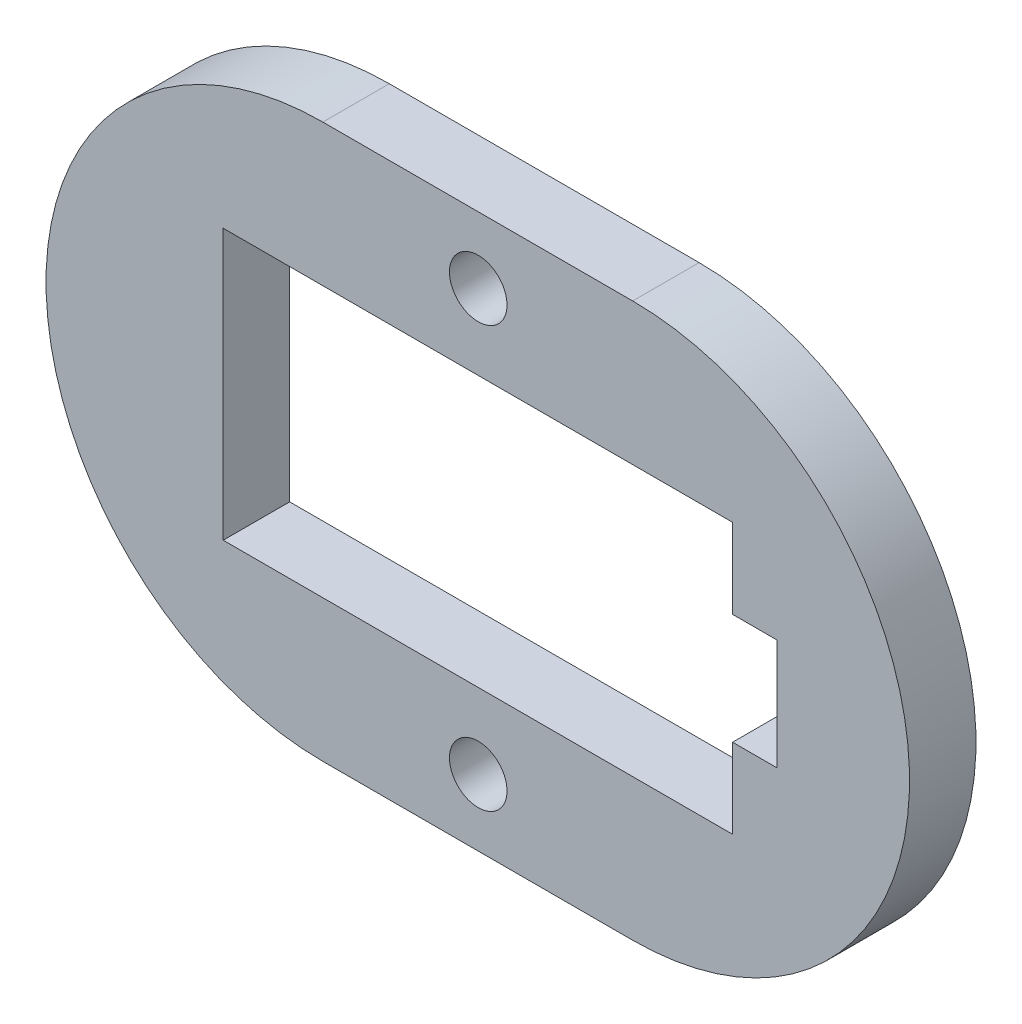
from build123d import *

# Parameters (mm, degrees)
SKETCH_1_R      = 1.3
EXTRUDE_1_DEPTH = 3


with BuildPart() as part:
    # 草图1 → 凸台-拉伸1 (new body)
    with BuildSketch(Plane.XY.offset(3)):
        with BuildLine():
            Line((-8.503322156, 0.0005), (5.486588529, 0.0005))
            ThreePointArc((5.486588529, 0.0005), (17.986588529, 12.5005), (5.486588529, 25.0005))
            Line((5.486588529, 25.0005), (-8.503322156, 25.0005))
            ThreePointArc((-8.503322156, 25.0005), (-21.003322156, 12.5005), (-8.503322156, 0.0005))
        make_face()
        with Locations(Location((-1.487905971, 2.9995, 0), (0, 0, 180))):
            Circle(SKETCH_1_R, mode=Mode.SUBTRACT)
        with Locations(Location((-1.487905971, 22.0005, 0), (0, 0, 180))):
            Circle(SKETCH_1_R, mode=Mode.SUBTRACT)
        Polygon((11.997794717, 15), (11.997794717, 10.001), (9.996894717, 10.001), (9.996894717, 6.4), (-13.002605283, 6.4), (-13.002605283, 18.6), (9.996894717, 18.6), (9.996894717, 15), align=None, mode=Mode.SUBTRACT)
    extrude(amount=-EXTRUDE_1_DEPTH)


solid = part.part
